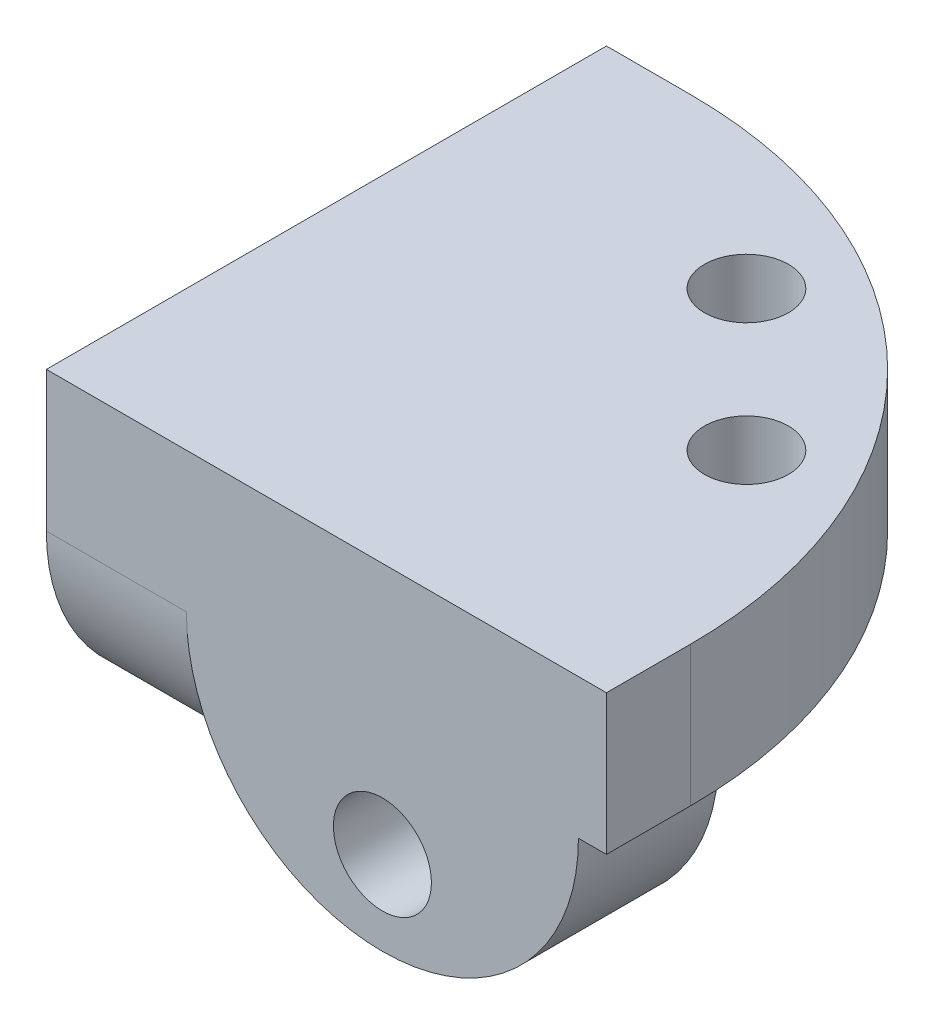
from build123d import *

# Parameters (mm, degrees)
SKETCH1_W           = 20
SKETCH1_H           = 20
SKETCH1_R           = 1.5
BOSS_EXTRUDE1_DEPTH = 5
SKETCH2_R           = 1.75
BOSS_EXTRUDE2_DEPTH = 5
SKETCH3_R           = 1.75
BOSS_EXTRUDE3_DEPTH = 5
FILLET1_R           = 17


with BuildPart() as part:
    # Sketch1 → Boss-Extrude1 (new body)
    with BuildSketch(Plane(origin=(0, 0, 0), x_dir=(1, 0, 0), z_dir=(0, 1, 0))):
        with Locations((10, 10)):
            Rectangle(SKETCH1_W, SKETCH1_H)
        with Locations(Location((10, 15, 0), (0, 0, 270))):
            Circle(SKETCH1_R, mode=Mode.SUBTRACT)
        with Locations(Location((15, 10, 0), (0, 0, 270))):
            Circle(SKETCH1_R, mode=Mode.SUBTRACT)
    extrude(amount=BOSS_EXTRUDE1_DEPTH)

    # Sketch2 → Boss-Extrude2 (add)
    with BuildSketch(Plane.XY):
        with BuildLine():
            Line((19, 0), (5, 0))
            ThreePointArc((5, 0), (12, -7), (19, 0))
        make_face()
        with Locations((12, -4)):
            Circle(SKETCH2_R, mode=Mode.SUBTRACT)
    extrude(amount=-BOSS_EXTRUDE2_DEPTH)

    # Sketch3 → Boss-Extrude3 (add)
    with BuildSketch(Plane.ZY):
        with BuildLine():
            Line((0, 0), (-14, 0))
            ThreePointArc((-14, 0), (-7, -7), (0, 0))
        make_face()
        with Locations((-7, -4)):
            Circle(SKETCH3_R, mode=Mode.SUBTRACT)
    extrude(amount=-BOSS_EXTRUDE3_DEPTH)

    # Fillet1
    fillet1_edges = [part.edges().sort_by_distance(p)[0] for p in [
        (20, 2.5, -20),
    ]]
    fillet(fillet1_edges, radius=FILLET1_R)


solid = part.part
